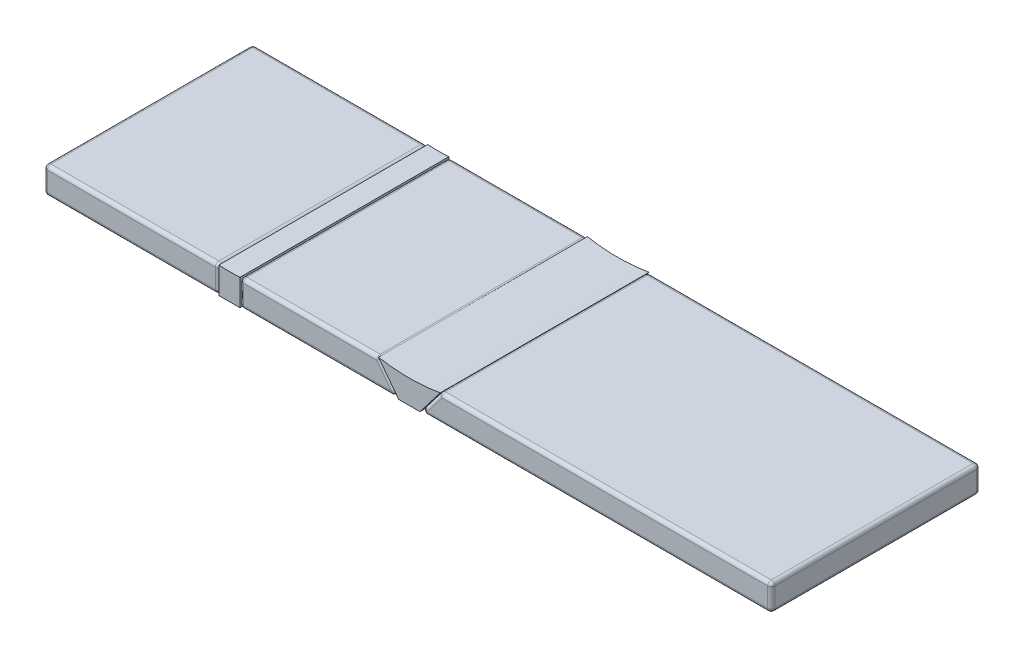
from build123d import *

# Parameters (mm, degrees)
BOSS_EXTRUDE1_DEPTH   = 296
BOSS_EXTRUDE1_2_DEPTH = 296
SKETCH1_W             = 496
SKETCH1_H             = 75
BOSS_EXTRUDE1_3_DEPTH = 296
FILLET1_R             = 10
FILLET2_R             = 10
FILLET3_R             = 10
BOSS_EXTRUDE2_DEPTH   = 296


with BuildPart() as part:
    # Sketch1 → Boss-Extrude1 (new, symmetric)
    with BuildSketch(Plane.XY):
        Polygon((553.177330143, 75), (495.627806045, 0), (1491.627806045, 0), (1491.627806045, 75), align=None)
    extrude(amount=BOSS_EXTRUDE1_DEPTH, both=True)

    # Fillet1
    fillet1_edges = [part.edges().sort_by_distance(p)[0] for p in [
        (524.402568094, 37.5, 296),
        (495.627806045, 0, 0),
        (993.627806045, 0, 296),
        (1491.627806045, 0, 0),
        (1491.627806045, 37.5, 296),
        (1491.627806045, 37.5, -296),
        (524.402568094, 37.5, -296),
        (993.627806045, 0, -296),
        (1491.627806045, 75, 0),
        (1022.402568094, 75, 296),
        (553.177330143, 75, 0),
        (1022.402568094, 75, -296),
    ]]
    fillet(fillet1_edges, radius=FILLET1_R)



with BuildPart() as body_2:
    # Sketch1 → Boss-Extrude1 2 (new, symmetric)
    with BuildSketch(Plane.XY):
        Polygon((-14.372193955, 0), (435.627806045, 0), (378.078281946, 75), (-14.372193955, 75), align=None)
    extrude(amount=BOSS_EXTRUDE1_2_DEPTH, both=True)

    # Fillet2
    fillet2_edges = [body_2.edges().sort_by_distance(p)[0] for p in [
        (181.853043996, 75, 296),
        (181.853043996, 75, -296),
        (406.853043996, 37.5, 296),
        (210.627806045, 0, 296),
        (-14.372193955, 37.5, 296),
        (210.627806045, 0, -296),
        (406.853043996, 37.5, -296),
        (-14.372193955, 37.5, -296),
        (378.078281946, 75, 0),
        (-14.372193955, 75, 0),
        (-14.372193955, 0, 0),
        (435.627806045, 0, 0),
    ]]
    fillet(fillet2_edges, radius=FILLET2_R)


with BuildPart() as body_3:
    # Sketch1 → Boss-Extrude1 3 (new, symmetric)
    with BuildSketch(Plane.XY):
        with Locations((-322.372193955, 37.5)):
            Rectangle(SKETCH1_W, SKETCH1_H)
    extrude(amount=BOSS_EXTRUDE1_3_DEPTH, both=True)

    # Fillet3
    fillet3_edges = [body_3.edges().sort_by_distance(p)[0] for p in [
        (-74.372193955, 37.5, -296),
        (-570.372193955, 37.5, -296),
        (-570.372193955, 0, 0),
        (-74.372193955, 0, 0),
        (-322.372193955, 0, -296),
        (-74.372193955, 37.5, 296),
        (-322.372193955, 0, 296),
        (-570.372193955, 37.5, 296),
        (-74.372193955, 75, 0),
        (-322.372193955, 75, 296),
        (-570.372193955, 75, 0),
        (-322.372193955, 75, -296),
    ]]
    fillet(fillet3_edges, radius=FILLET3_R)


with BuildPart() as part_1:
    add(part.part)

    add(body_2.part)  # Boss-Extrude2 merges body 2

    add(body_3.part)  # Boss-Extrude2 merges body 3
    # Sketch1<3> → Boss-Extrude2 (add, symmetric)
    with BuildSketch(Plane.XY):
        with BuildLine():
            Line((435.627806045, 0), (495.627806045, 0))
            Line((495.627806045, 0), (553.177330143, 75))
            ThreePointArc((553.177330143, 75), (465.627806045, 67.275411564), (378.078281946, 75))
            Line((378.078281946, 75), (435.627806045, 0))
        make_face()
        with BuildLine():
            Line((-74.372193955, 0), (-14.372193955, 0))
            Line((-14.372193955, 0), (-14.372193955, 75))
            ThreePointArc((-14.372193955, 75), (-44.372193955, 73.873413504), (-74.372193955, 75))
            Line((-74.372193955, 75), (-74.372193955, 0))
        make_face()
    extrude(amount=BOSS_EXTRUDE2_DEPTH, both=True)


solid = part_1.part
